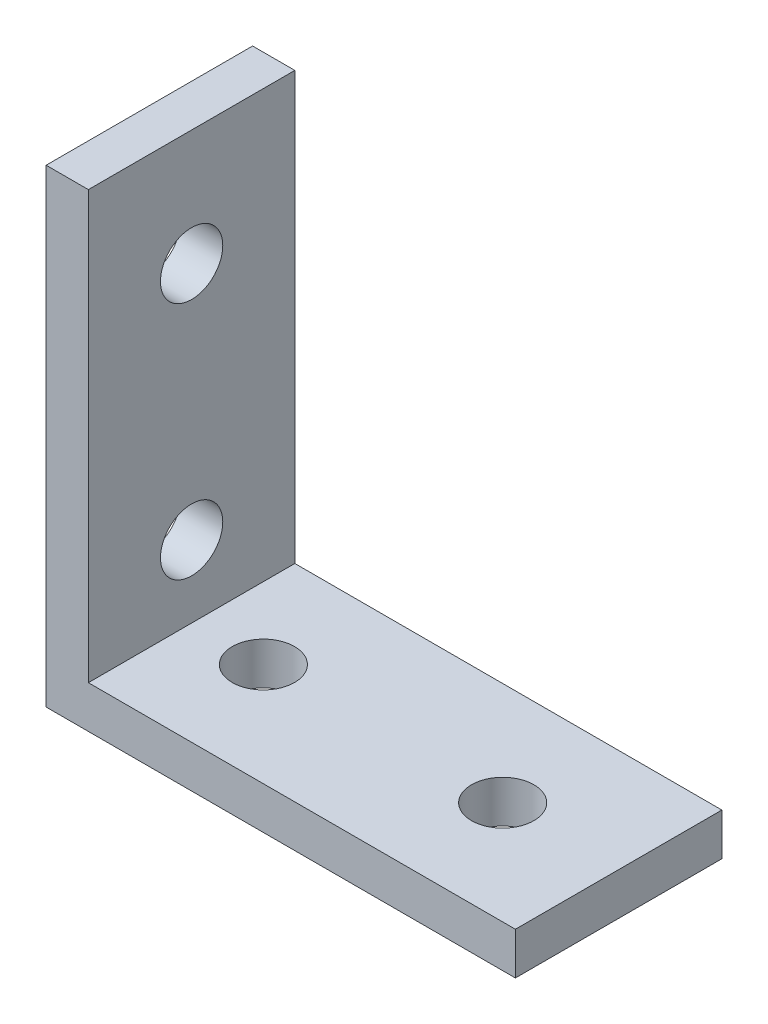
from build123d import *

# Parameters (mm, degrees)
SKETCH1_W                                  = 50.8
SKETCH1_H                                  = 22.352
BOSS_EXTRUDE1_DEPTH                        = 50.8
CUT_EXTRUDE2_DEPTH                         = 76.238898876
CUT_EXTRUDE2_DEPTH_BACK                    = 76.238898876
F_17_64_0_26563_DIAMETER_HOLE1_D           = 6.747002
F_17_64_0_26563_DIAMETER_HOLE1_ON_FACE_2_D = 6.747002


with BuildPart() as part:
    # Sketch1 → Boss-Extrude1 (new body)
    with BuildSketch(Plane(origin=(0, 0, 0), x_dir=(1, 0, 0), z_dir=(0, 1, 0))):
        with Locations((25.4, 11.176)):
            Rectangle(SKETCH1_W, SKETCH1_H)
    extrude(amount=BOSS_EXTRUDE1_DEPTH)

    # Sketch2 → Cut-Extrude2 (cut, two sides: drawn at the far end of the back side and taken through both)
    with BuildSketch(Plane.XY.offset(-CUT_EXTRUDE2_DEPTH_BACK)):
        Polygon((4.572, 198.1705643), (4.572, 50.8), (4.572, 4.572), (50.8, 4.572), (198.1705643, 4.572), (406.584015027, 212.985450727), (212.985450727, 406.584015027), align=None)
    extrude(amount=CUT_EXTRUDE2_DEPTH + CUT_EXTRUDE2_DEPTH_BACK, mode=Mode.SUBTRACT)

    # 17/64 (0.26563) Diameter Hole1 (through all)
    with Locations(Plane(origin=(4.572, 12.374496691, -11.175999046), x_dir=(0, 0, 1), z_dir=(1, 0, 0))):
        with Locations((0, 0), (-9.54e-07, -25.904093129)):
            Hole(F_17_64_0_26563_DIAMETER_HOLE1_D / 2)

    # 17/64 (0.26563) Diameter Hole1 on face 2 (through all)
    with Locations(Plane(origin=(12.343199837, 4.572, -11.175998262), x_dir=(0, 0, 1), z_dir=(0, 1, 0))):
        with Locations((0, 0), (-1.738e-06, 25.906798937)):
            Hole(F_17_64_0_26563_DIAMETER_HOLE1_ON_FACE_2_D / 2)


solid = part.part
